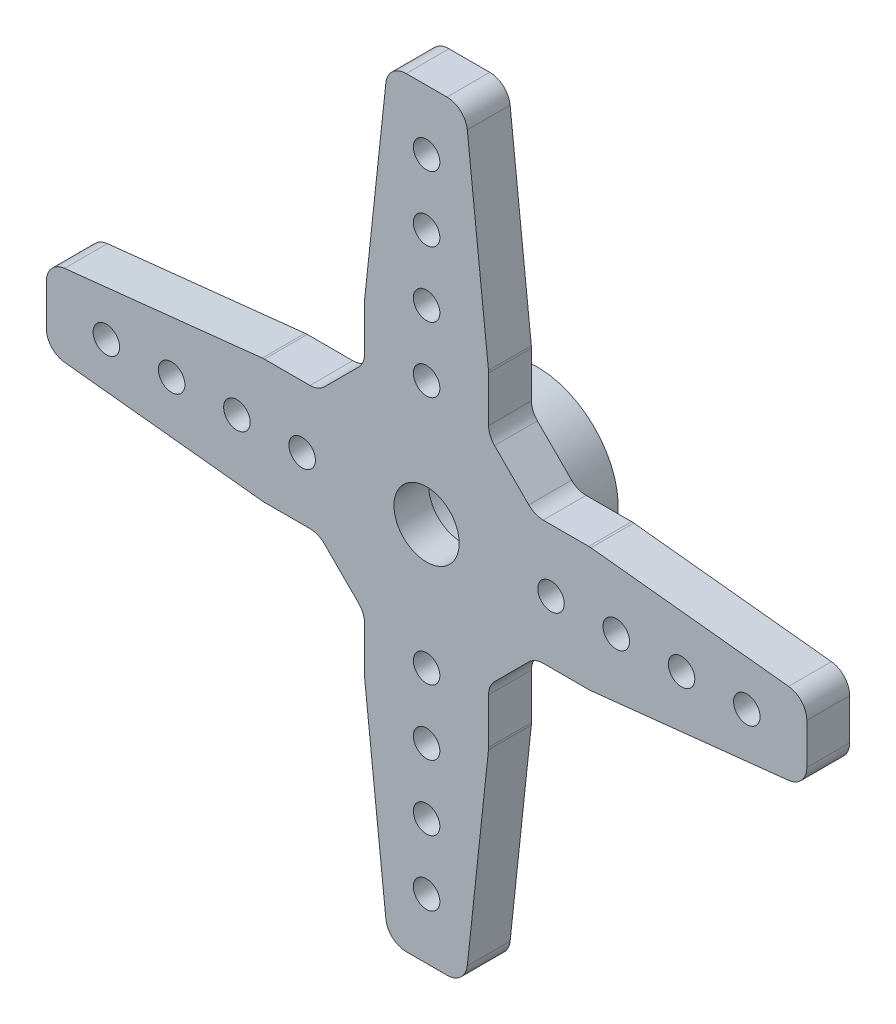
from build123d import *

# Parameters (mm, degrees)
SKETCH1_R           = 4
SKETCH1_R_2         = 1.6
BOSS_EXTRUDE1_DEPTH = 5.4
BOSS_EXTRUDE2_START = -2.1
SKETCH2_R           = 1.6
SKETCH2_R_2         = 0.65
BOSS_EXTRUDE2_DEPTH = 2.1
SKETCH3_R           = 2.5
CUT_EXTRUDE1_DEPTH  = 3.7


with BuildPart() as part:
    # Sketch1 → Boss-Extrude1 (new body)
    with BuildSketch(Plane.XY):
        with Locations(Location((0, 0, 0), (0, 0, 180))):
            Circle(SKETCH1_R)
        with Locations(Location((0, 0, 0), (0, 0, 180))):
            Circle(SKETCH1_R_2, mode=Mode.SUBTRACT)
    extrude(amount=BOSS_EXTRUDE1_DEPTH)

    # Sketch2 → Boss-Extrude2 (add)
    with BuildSketch(Plane.XY.offset(5.4).offset(BOSS_EXTRUDE2_START)):
        with BuildLine():
            Line((4.171930009, 4.171930009), (3.333452378, 5.01040764))
            ThreePointArc((3.333452378, 5.01040764), (3.116679627, 5.334830989), (3.040559159, 5.717514421))
            Line((3.040559159, 5.717514421), (3.040559159, 7.94985144))
            ThreePointArc((3.040559159, 7.94985144), (3.039133792, 8.003224674), (3.034861755, 8.056445754))
            Line((3.034861755, 8.056445754), (1.99577765, 17.748932949))
            ThreePointArc((1.99577765, 17.748932949), (1.669833374, 18.386178105), (1.001475054, 18.642338635))
            Line((1.001475054, 18.642338635), (-1.001475054, 18.642338635))
            ThreePointArc((-1.001475054, 18.642338635), (-1.669833374, 18.386178105), (-1.99577765, 17.748932949))
            Line((-1.99577765, 17.748932949), (-3.034861755, 8.056445754))
            ThreePointArc((-3.034861755, 8.056445754), (-3.039133792, 8.003224674), (-3.040559159, 7.94985144))
            Line((-3.040559159, 7.94985144), (-3.040559159, 5.717514421))
            ThreePointArc((-3.040559159, 5.717514421), (-3.116679627, 5.334830989), (-3.333452378, 5.01040764))
            Line((-3.333452378, 5.01040764), (-4.171930009, 4.171930009))
            Line((-4.171930009, 4.171930009), (-5.01040764, 3.333452378))
            ThreePointArc((-5.01040764, 3.333452378), (-5.334830989, 3.116679627), (-5.717514421, 3.040559159))
            Line((-5.717514421, 3.040559159), (-7.94985144, 3.040559159))
            ThreePointArc((-7.94985144, 3.040559159), (-8.003224674, 3.039133792), (-8.056445754, 3.034861755))
            Line((-8.056445754, 3.034861755), (-17.748932949, 1.99577765))
            ThreePointArc((-17.748932949, 1.99577765), (-18.386178105, 1.669833374), (-18.642338635, 1.001475054))
            Line((-18.642338635, 1.001475054), (-18.642338635, -1.001475054))
            ThreePointArc((-18.642338635, -1.001475054), (-18.386178105, -1.669833374), (-17.748932949, -1.99577765))
            Line((-17.748932949, -1.99577765), (-8.056445754, -3.034861755))
            ThreePointArc((-8.056445754, -3.034861755), (-8.003224674, -3.039133792), (-7.94985144, -3.040559159))
            Line((-7.94985144, -3.040559159), (-5.717514421, -3.040559159))
            ThreePointArc((-5.717514421, -3.040559159), (-5.334830989, -3.116679627), (-5.01040764, -3.333452378))
            Line((-5.01040764, -3.333452378), (-4.171930009, -4.171930009))
            Line((-4.171930009, -4.171930009), (-3.333452378, -5.01040764))
            ThreePointArc((-3.333452378, -5.01040764), (-3.116679627, -5.334830989), (-3.040559159, -5.717514421))
            Line((-3.040559159, -5.717514421), (-3.040559159, -7.94985144))
            ThreePointArc((-3.040559159, -7.94985144), (-3.039133792, -8.003224674), (-3.034861755, -8.056445754))
            Line((-3.034861755, -8.056445754), (-1.99577765, -17.748932949))
            ThreePointArc((-1.99577765, -17.748932949), (-1.669833374, -18.386178105), (-1.001475054, -18.642338635))
            Line((-1.001475054, -18.642338635), (1.001475054, -18.642338635))
            ThreePointArc((1.001475054, -18.642338635), (1.669833374, -18.386178105), (1.99577765, -17.748932949))
            Line((1.99577765, -17.748932949), (3.034861755, -8.056445754))
            ThreePointArc((3.034861755, -8.056445754), (3.039133792, -8.003224674), (3.040559159, -7.94985144))
            Line((3.040559159, -7.94985144), (3.040559159, -5.717514421))
            ThreePointArc((3.040559159, -5.717514421), (3.116679627, -5.334830989), (3.333452378, -5.01040764))
            Line((3.333452378, -5.01040764), (4.171930009, -4.171930009))
            Line((4.171930009, -4.171930009), (5.01040764, -3.333452378))
            ThreePointArc((5.01040764, -3.333452378), (5.334830989, -3.116679627), (5.717514421, -3.040559159))
            Line((5.717514421, -3.040559159), (7.94985144, -3.040559159))
            ThreePointArc((7.94985144, -3.040559159), (8.003224674, -3.039133792), (8.056445754, -3.034861755))
            Line((8.056445754, -3.034861755), (17.748932949, -1.99577765))
            ThreePointArc((17.748932949, -1.99577765), (18.386178105, -1.669833374), (18.642338635, -1.001475054))
            Line((18.642338635, -1.001475054), (18.642338635, 1.001475054))
            ThreePointArc((18.642338635, 1.001475054), (18.386178105, 1.669833374), (17.748932949, 1.99577765))
            Line((17.748932949, 1.99577765), (8.056445754, 3.034861755))
            ThreePointArc((8.056445754, 3.034861755), (8.003224674, 3.039133792), (7.94985144, 3.040559159))
            Line((7.94985144, 3.040559159), (5.717514421, 3.040559159))
            ThreePointArc((5.717514421, 3.040559159), (5.334830989, 3.116679627), (5.01040764, 3.333452378))
            Line((5.01040764, 3.333452378), (4.171930009, 4.171930009))
        make_face()
        with Locations(Location((0, 0, 0), (0, 0, 180))):
            Circle(SKETCH2_R, mode=Mode.SUBTRACT)
        with Locations((0, 6.1)):
            Circle(SKETCH2_R_2, mode=Mode.SUBTRACT)
        with Locations((0, 9.3)):
            Circle(SKETCH2_R_2, mode=Mode.SUBTRACT)
        with Locations((0, 12.5)):
            Circle(SKETCH2_R_2, mode=Mode.SUBTRACT)
        with Locations((0, 15.7)):
            Circle(SKETCH2_R_2, mode=Mode.SUBTRACT)
        with Locations((15.7, 0)):
            Circle(SKETCH2_R_2, mode=Mode.SUBTRACT)
        with Locations((12.5, 0)):
            Circle(SKETCH2_R_2, mode=Mode.SUBTRACT)
        with Locations((9.3, 0)):
            Circle(SKETCH2_R_2, mode=Mode.SUBTRACT)
        with Locations((6.1, 0)):
            Circle(SKETCH2_R_2, mode=Mode.SUBTRACT)
        with Locations((0, -15.7)):
            Circle(SKETCH2_R_2, mode=Mode.SUBTRACT)
        with Locations((0, -12.5)):
            Circle(SKETCH2_R_2, mode=Mode.SUBTRACT)
        with Locations((0, -9.3)):
            Circle(SKETCH2_R_2, mode=Mode.SUBTRACT)
        with Locations((0, -6.1)):
            Circle(SKETCH2_R_2, mode=Mode.SUBTRACT)
        with Locations((-15.7, 0)):
            Circle(SKETCH2_R_2, mode=Mode.SUBTRACT)
        with Locations((-12.5, 0)):
            Circle(SKETCH2_R_2, mode=Mode.SUBTRACT)
        with Locations((-9.3, 0)):
            Circle(SKETCH2_R_2, mode=Mode.SUBTRACT)
        with Locations((-6.1, 0)):
            Circle(SKETCH2_R_2, mode=Mode.SUBTRACT)
    extrude(amount=BOSS_EXTRUDE2_DEPTH)

    # Sketch3 → Cut-Extrude1 (cut)
    with BuildSketch(Plane(origin=(0, 0, 0), x_dir=(-1, 0, 0), z_dir=(0, 0, -1))):
        Circle(SKETCH3_R)
    extrude(amount=-CUT_EXTRUDE1_DEPTH, mode=Mode.SUBTRACT)


solid = part.part
